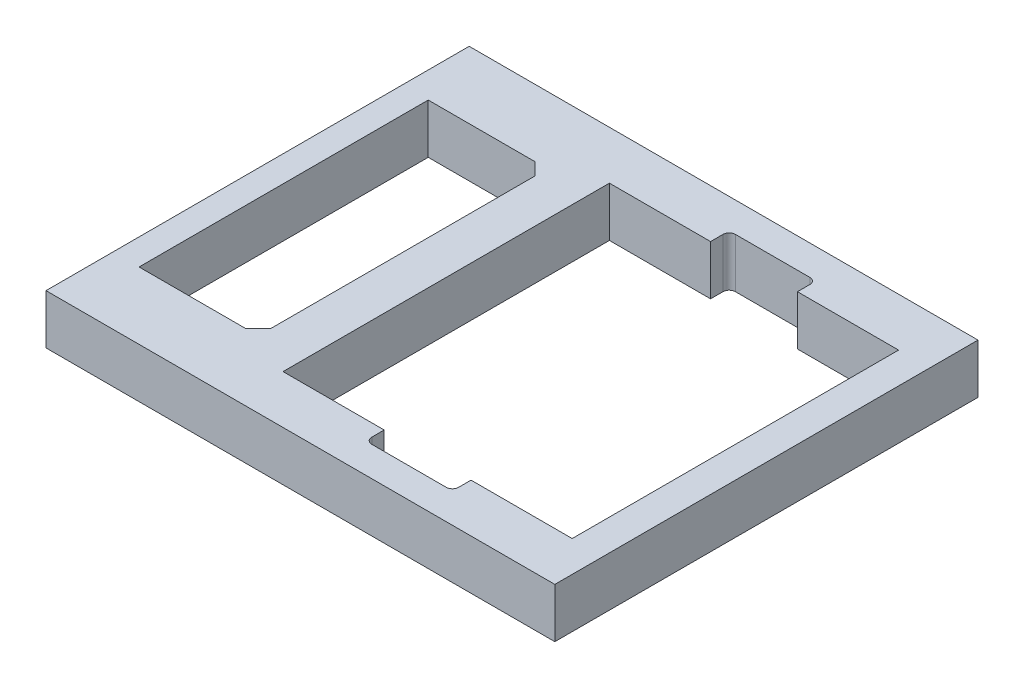
from build123d import *

# Parameters (mm, degrees)
SKETCH1_W           = 410
SKETCH1_H           = 341
BOSS_EXTRUDE1_DEPTH = 40


with BuildPart() as part:
    # Sketch1 → Boss-Extrude1 (new body)
    with BuildSketch(Plane(origin=(0, 0, 0), x_dir=(1, 0, 0), z_dir=(0, 1, 0))):
        Rectangle(SKETCH1_W, SKETCH1_H)
        with BuildLine():
            Line((28.5, 131.5), (28.5, 141.5))
            ThreePointArc((28.5, 141.5), (29.964466094, 145.035533906), (33.5, 146.5))
            Line((33.5, 146.5), (93.5, 146.5))
            ThreePointArc((93.5, 146.5), (97.035533906, 145.035533906), (98.5, 141.5))
            Line((98.5, 141.5), (98.5, 131.5))
            Line((98.5, 131.5), (180, 131.5))
            Line((180, 131.5), (180, -131.5))
            Line((180, -131.5), (98.5, -131.5))
            Line((98.5, -131.5), (98.5, -141.5))
            ThreePointArc((98.5, -141.5), (97.035533906, -145.035533906), (93.5, -146.5))
            Line((93.5, -146.5), (33.5, -146.5))
            ThreePointArc((33.5, -146.5), (29.964466094, -145.035533906), (28.5, -141.5))
            Line((28.5, -141.5), (28.5, -131.5))
            Line((28.5, -131.5), (-53, -131.5))
            Line((-53, -131.5), (-53, 131.5))
            Line((-53, 131.5), (28.5, 131.5))
        make_face(mode=Mode.SUBTRACT)
        Polygon((-184, -116.5), (-98, -116.5), (-88, -106.5), (-88, 106.5), (-98, 116.5), (-184, 116.5), align=None, mode=Mode.SUBTRACT)
    extrude(amount=BOSS_EXTRUDE1_DEPTH)


solid = part.part
